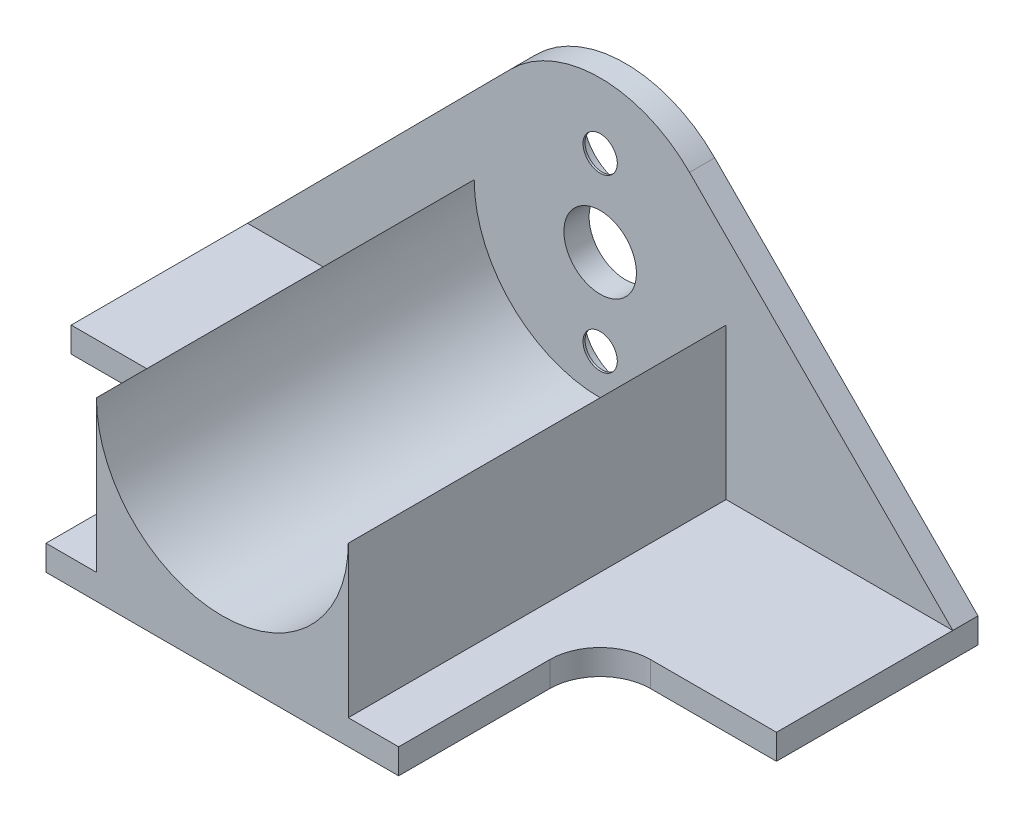
from build123d import *

# Parameters (mm, degrees)
BOSS_EXTRUDE1_DEPTH                              = 2.5
FILLET1_R                                        = 5
SKETCH3_W                                        = 70
SKETCH3_H                                        = 2.5
BOSS_EXTRUDE2_DEPTH                              = 30
CUT_EXTRUDE1_REACH                               = 62.725
BOSS_EXTRUDE3_DEPTH                              = 37.5
CUT_EXTRUDE3_REACH                               = 62.725
SKETCH10_R                                       = 3.6
CBORE_FOR_M3_HEX_HEAD_MACHINE_SCREW1_D           = 3.4
CBORE_FOR_M3_HEX_HEAD_MACHINE_SCREW1_CBORE_D     = 8.4
CBORE_FOR_M3_HEX_HEAD_MACHINE_SCREW1_CBORE_DEPTH = 2.3


with BuildPart() as part:
    # Sketch2 → Boss-Extrude1 (new body)
    with BuildSketch(Plane(origin=(0, 0, 0), x_dir=(1, 0, 0), z_dir=(0, 1, 0))):
        Polygon((-17.5, -30), (17.5, -30), (17.5, -10), (35, -10), (35, 10), (-35, 10), (-35, -10), (-17.5, -10), align=None)
    extrude(amount=BOSS_EXTRUDE1_DEPTH)

    # Fillet1
    fillet1_edges = [part.edges().sort_by_distance(p)[0] for p in [
        (-17.5, 1.25, 10),
        (17.5, 1.25, 10),
    ]]
    fillet(fillet1_edges, radius=FILLET1_R)

    # Sketch3 → Boss-Extrude2 (add)
    with BuildSketch(Plane(origin=(0, 2.5, 0), x_dir=(1, 0, 0), z_dir=(0, 1, 0))):
        with Locations((0, 8.75)):
            Rectangle(SKETCH3_W, SKETCH3_H)
    extrude(amount=BOSS_EXTRUDE2_DEPTH)

    # Sketch4 → Cut-Extrude1 (cut, up to next)
    with BuildSketch(Plane.XY.offset(-7.5), mode=Mode.PRIVATE) as cut_extrude1_sk1:
        with BuildLine():
            Line((-35, 32.5), (-35, 2.5))
            Line((-35, 2.5), (-8.868713205, 28.808854982))
            ThreePointArc((-8.868713205, 28.808854982), (-4.803088197, 31.54037884), (3.1e-08, 32.5))
            Line((3.1e-08, 32.5), (-35, 32.5))
        make_face()
    cut_extrude1_tool1 = extrude(cut_extrude1_sk1.sketch, amount=-CUT_EXTRUDE1_REACH, mode=Mode.PRIVATE) & part.part
    # Sketch4 → Cut-Extrude1 (cut, up to next)
    with BuildSketch(Plane.XY.offset(-7.5), mode=Mode.PRIVATE) as cut_extrude1_sk2:
        with BuildLine():
            Line((35, 32.5), (3.1e-08, 32.5))
            ThreePointArc((3.1e-08, 32.5), (4.803088226, 31.540378828), (8.868713205, 28.808854982))
            Line((8.868713205, 28.808854982), (35, 2.5))
            Line((35, 2.5), (35, 32.5))
        make_face()
    cut_extrude1_tool2 = extrude(cut_extrude1_sk2.sketch, amount=-CUT_EXTRUDE1_REACH, mode=Mode.PRIVATE) & part.part
    add(cut_extrude1_tool1.solids().sort_by_distance((-24.914818, 22.569917, -7.5))[0], mode=Mode.SUBTRACT)
    add(cut_extrude1_tool2.solids().sort_by_distance((24.914818, 22.569917, -7.5))[0], mode=Mode.SUBTRACT)

    # Sketch7 → Boss-Extrude3 (add)
    with BuildSketch(Plane.XY.offset(-7.5)):
        with BuildLine():
            Line((12.5, 17.5), (12.5, 2.5))
            Line((12.5, 2.5), (-12.5, 2.5))
            Line((-12.5, 2.5), (-12.5, 17.5))
            ThreePointArc((-12.5, 17.5), (0, 5), (12.5, 17.5))
        make_face()
    extrude(amount=BOSS_EXTRUDE3_DEPTH)

    # Sketch10 → Cut-Extrude3 (cut, up to next)
    with BuildSketch(Plane.XY.offset(-7.5), mode=Mode.PRIVATE) as cut_extrude3_sk1:
        with Locations((0, 17.5)):
            Circle(SKETCH10_R)
    cut_extrude3_tool1 = extrude(cut_extrude3_sk1.sketch, amount=-CUT_EXTRUDE3_REACH, mode=Mode.PRIVATE) & part.part
    add(cut_extrude3_tool1.solids().sort_by_distance((0, 17.5, -7.5))[0], mode=Mode.SUBTRACT)

    # CBORE for M3 Hex Head Machine Screw1 (through all)
    with Locations(Plane(origin=(0, 0, -10), x_dir=(-1, 0, 0), z_dir=(0, 0, -1))):
        with Locations((0, 26), (0, 9)):
            CounterBoreHole(CBORE_FOR_M3_HEX_HEAD_MACHINE_SCREW1_D / 2, CBORE_FOR_M3_HEX_HEAD_MACHINE_SCREW1_CBORE_D / 2, CBORE_FOR_M3_HEX_HEAD_MACHINE_SCREW1_CBORE_DEPTH)


solid = part.part
